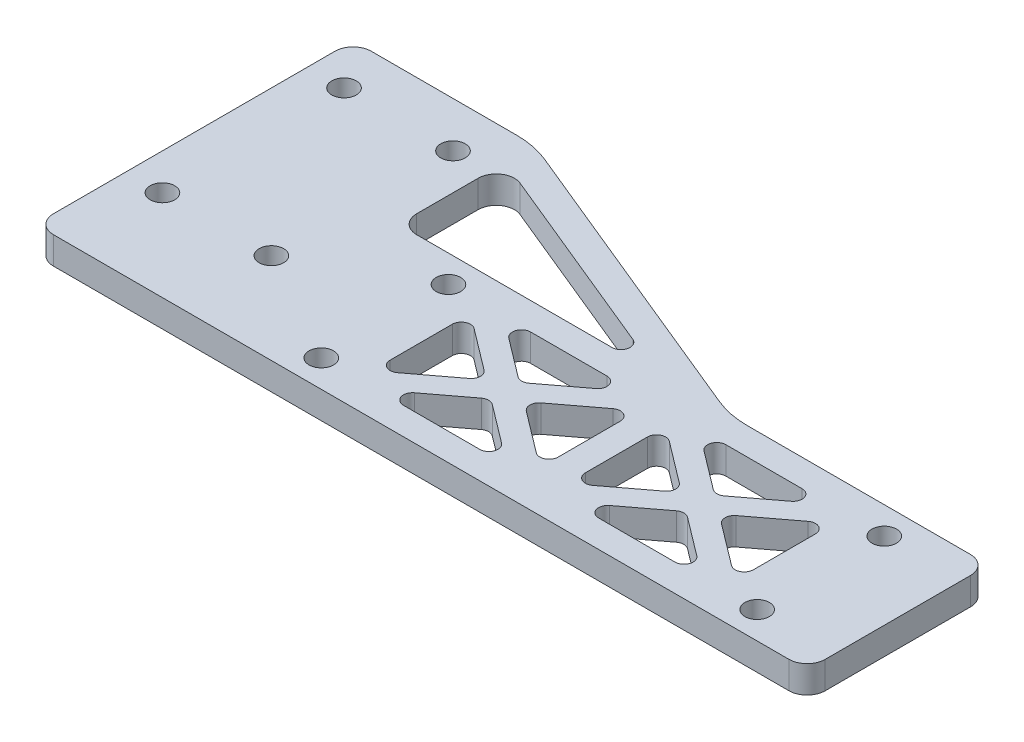
from build123d import *
from OCP.BRepFilletAPI import BRepFilletAPI_MakeFillet

# Parameters (mm, degrees)
SKETCH_1_R          = 1.35
EXTRUDE_1_DEPTH     = 3
EXTRUDE_2_DEPTH     = 3
CUT_EXTRUDE_1_DEPTH = 10
FILLET_1_R1         = 1
FILLET_1_R2         = 2
FILLET_1_R3         = 10
FILLET_2_R          = 1


with BuildPart() as part:
    # 草图1 → 凸台-拉伸1 (new body)
    with BuildSketch(Plane(origin=(0, 0, 0), x_dir=(1, 0, 0), z_dir=(0, 1, 0))):
        Polygon((0, 35), (20, 35), (20, 20), (85, 20), (85, 0), (0, 0), (0, 10), align=None)
        with Locations(Location((76.5, 3, 0), (0, 0, 270))):
            Circle(SKETCH_1_R, mode=Mode.SUBTRACT)
        with Locations(Location((76.5, 17, 0), (0, 0, 90))):
            Circle(SKETCH_1_R, mode=Mode.SUBTRACT)
        with Locations(Location((28.5, 17, 0), (0, 0, 270))):
            Circle(SKETCH_1_R, mode=Mode.SUBTRACT)
        with Locations(Location((28.5, 3, 0), (0, 0, 90))):
            Circle(SKETCH_1_R, mode=Mode.SUBTRACT)
        with Locations(Location((4, 10, 0), (0, 0, 270))):
            Circle(SKETCH_1_R, mode=Mode.SUBTRACT)
        with Locations(Location((4, 30, 0), (0, 0, 90))):
            Circle(SKETCH_1_R, mode=Mode.SUBTRACT)
        with Locations(Location((16, 30, 0), (0, 0, 270))):
            Circle(SKETCH_1_R, mode=Mode.SUBTRACT)
        with Locations(Location((16, 10, 0), (0, 0, 90))):
            Circle(SKETCH_1_R, mode=Mode.SUBTRACT)
    extrude(amount=EXTRUDE_1_DEPTH)

    # 草图3 → 凸台-拉伸2 (add)
    with BuildSketch(Plane.XZ):
        Polygon((20, -31.755784464), (20, -35), (56.44071813, -20), (48.55928187, -20), align=None)
    extrude(amount=-EXTRUDE_2_DEPTH)

    # 草图4 → 切除-拉伸1 (cut)
    with BuildSketch(Plane.XZ):
        Polygon((34.571447814, -3), (41.75, -8.432417871), (48.928552186, -3), align=None)
        Polygon((32.5, -4.567582129), (32.5, -15.432417871), (39.678552186, -10), align=None)
        Polygon((41.75, -11.567582129), (34.571447814, -17), (48.928552186, -17), align=None)
        Polygon((51, -4.567582129), (43.821447814, -10), (51, -15.432417871), align=None)
        Polygon((54, -15.432417871), (61.178552186, -10), (54, -4.567582129), align=None)
        Polygon((70.428552186, -3), (56.071447814, -3), (63.25, -8.432417871), align=None)
        Polygon((72.5, -4.567582129), (65.321447814, -10), (72.5, -15.432417871), align=None)
        Polygon((70.428552186, -17), (63.25, -11.567582129), (56.071447814, -17), align=None)
    extrude(amount=-CUT_EXTRUDE_1_DEPTH, mode=Mode.SUBTRACT)

    # 圆角1: one fillet with a radius per group of edges: ONE call of the kernel's fillet builder (fillet() takes one radius for all edges)
    fillet_1_edges_1 = [part.edges().sort_by_distance(p)[0] for p in [
        (48.55928187, 1.5, -20),
    ]]
    fillet_1_edges_2 = [part.edges().sort_by_distance(p)[0] for p in [
        (20, 1.5, -20),
        (20, 1.5, -31.755784464),
        (0, 1.5, -35),
        (0, 1.5, 0),
        (85, 1.5, 0),
        (85, 1.5, -20),
    ]]
    fillet_1_edges_3 = [part.edges().sort_by_distance(p)[0] for p in [
        (56.44071813, 1.5, -20),
        (20, 1.5, -35),
    ]]
    fillet_1 = BRepFilletAPI_MakeFillet(part.part.solid().wrapped)
    for e in fillet_1_edges_1:
        fillet_1.Add(FILLET_1_R1, e.wrapped)
    for e in fillet_1_edges_2:
        fillet_1.Add(FILLET_1_R2, e.wrapped)
    for e in fillet_1_edges_3:
        fillet_1.Add(FILLET_1_R3, e.wrapped)
    add(Compound.cast(fillet_1.Shape()), mode=Mode.REPLACE)

    # 圆角2
    fillet_2_edges = [part.edges().sort_by_distance(p)[0] for p in [
        (43.821447814, 1.5, -10),
        (51, 1.5, -4.567582129),
        (51, 1.5, -15.432417871),
        (39.678552186, 1.5, -10),
        (32.5, 1.5, -15.432417871),
        (32.5, 1.5, -4.567582129),
        (34.571447814, 1.5, -17),
        (41.75, 1.5, -11.567582129),
        (48.928552186, 1.5, -17),
        (70.428552186, 1.5, -17),
        (56.071447814, 1.5, -17),
        (63.25, 1.5, -11.567582129),
        (70.428552186, 1.5, -3),
        (63.25, 1.5, -8.432417871),
        (56.071447814, 1.5, -3),
        (72.5, 1.5, -15.432417871),
        (65.321447814, 1.5, -10),
        (72.5, 1.5, -4.567582129),
        (48.928552186, 1.5, -3),
        (41.75, 1.5, -8.432417871),
        (34.571447814, 1.5, -3),
        (54, 1.5, -15.432417871),
        (54, 1.5, -4.567582129),
        (61.178552186, 1.5, -10),
    ]]
    fillet(fillet_2_edges, radius=FILLET_2_R)


solid = part.part
